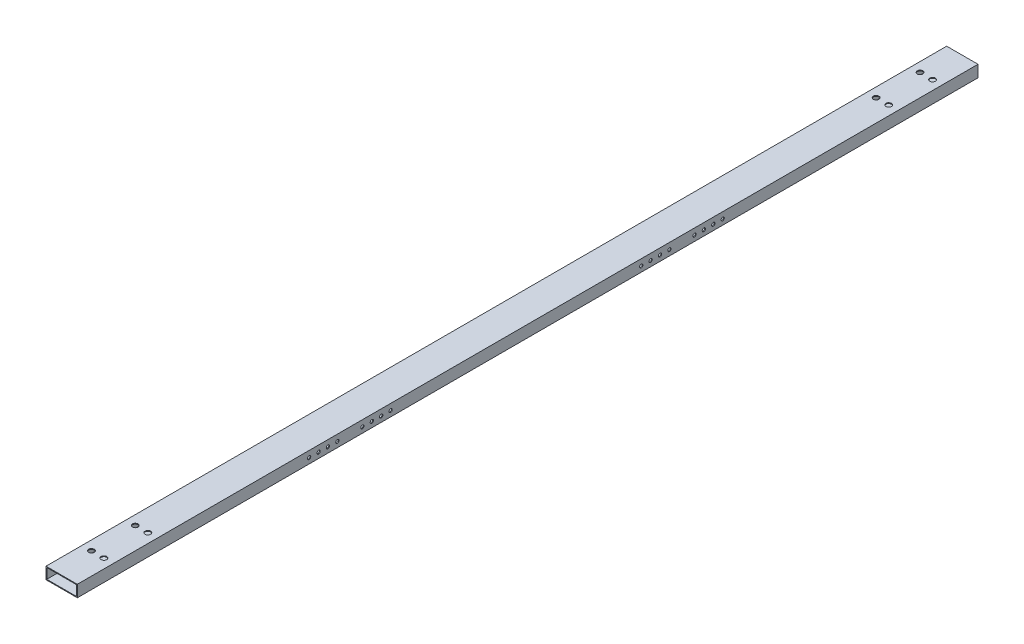
from build123d import *

# Parameters (mm, degrees)
SKETCH_1_W          = 40
SKETCH_1_H          = 15
SKETCH_1_W_2        = 38
SKETCH_1_H_2        = 13
EXTRUDE_1_DEPTH     = 1150
SKETCH_2_R          = 3.575
CUT_EXTRUDE_1_DEPTH = 1151.793204707
SKETCH_3_R          = 2.1
CUT_EXTRUDE_2_DEPTH = 1151.793204707


with BuildPart() as part:
    # 草图1 → 凸台-拉伸1 (new body)
    with BuildSketch(Plane.XY):
        with Locations((20, 7.5)):
            Rectangle(SKETCH_1_W, SKETCH_1_H)
        with Locations((20, 7.5)):
            Rectangle(SKETCH_1_W_2, SKETCH_1_H_2, mode=Mode.SUBTRACT)
    extrude(amount=EXTRUDE_1_DEPTH)

    # 草图2 → 切除-拉伸1 (cut, through all)
    with BuildSketch(Plane.XZ):
        with Locations(Location((12, 46, 0), (0, 0, 270))):
            Circle(SKETCH_2_R)
        with Locations(Location((28, 46, 0), (0, 0, 270))):
            Circle(SKETCH_2_R)
        with Locations(Location((12, 102, 0), (0, 0, 270))):
            Circle(SKETCH_2_R)
        with Locations(Location((28, 102, 0), (0, 0, 270))):
            Circle(SKETCH_2_R)
        with Locations(Location((12, 1104, 0), (0, 0, 270))):
            Circle(SKETCH_2_R)
        with Locations(Location((28, 1104, 0), (0, 0, 270))):
            Circle(SKETCH_2_R)
        with Locations(Location((12, 1048, 0), (0, 0, 270))):
            Circle(SKETCH_2_R)
        with Locations(Location((28, 1048, 0), (0, 0, 270))):
            Circle(SKETCH_2_R)
    extrude(amount=-CUT_EXTRUDE_1_DEPTH, mode=Mode.SUBTRACT)

    # 草图3 → 切除-拉伸2 (cut, through all)
    with BuildSketch(Plane(origin=(40, 0, 0), x_dir=(0, 0, -1), z_dir=(1, 0, 0))):
        with Locations((-430, 7)):
            Circle(SKETCH_3_R)
        with Locations((-418, 7)):
            Circle(SKETCH_3_R)
        with Locations((-338, 7)):
            Circle(SKETCH_3_R)
        with Locations((-326, 7)):
            Circle(SKETCH_3_R)
        with Locations((-406, 7)):
            Circle(SKETCH_3_R)
        with Locations((-394, 7)):
            Circle(SKETCH_3_R)
        with Locations((-362, 7)):
            Circle(SKETCH_3_R)
        with Locations((-350, 7)):
            Circle(SKETCH_3_R)
        with Locations((-854, 7)):
            Circle(SKETCH_3_R)
        with Locations((-842, 7)):
            Circle(SKETCH_3_R)
        with Locations((-762, 7)):
            Circle(SKETCH_3_R)
        with Locations((-750, 7)):
            Circle(SKETCH_3_R)
        with Locations((-830, 7)):
            Circle(SKETCH_3_R)
        with Locations((-818, 7)):
            Circle(SKETCH_3_R)
        with Locations((-786, 7)):
            Circle(SKETCH_3_R)
        with Locations((-774, 7)):
            Circle(SKETCH_3_R)
    extrude(amount=-CUT_EXTRUDE_2_DEPTH, mode=Mode.SUBTRACT)


solid = part.part
